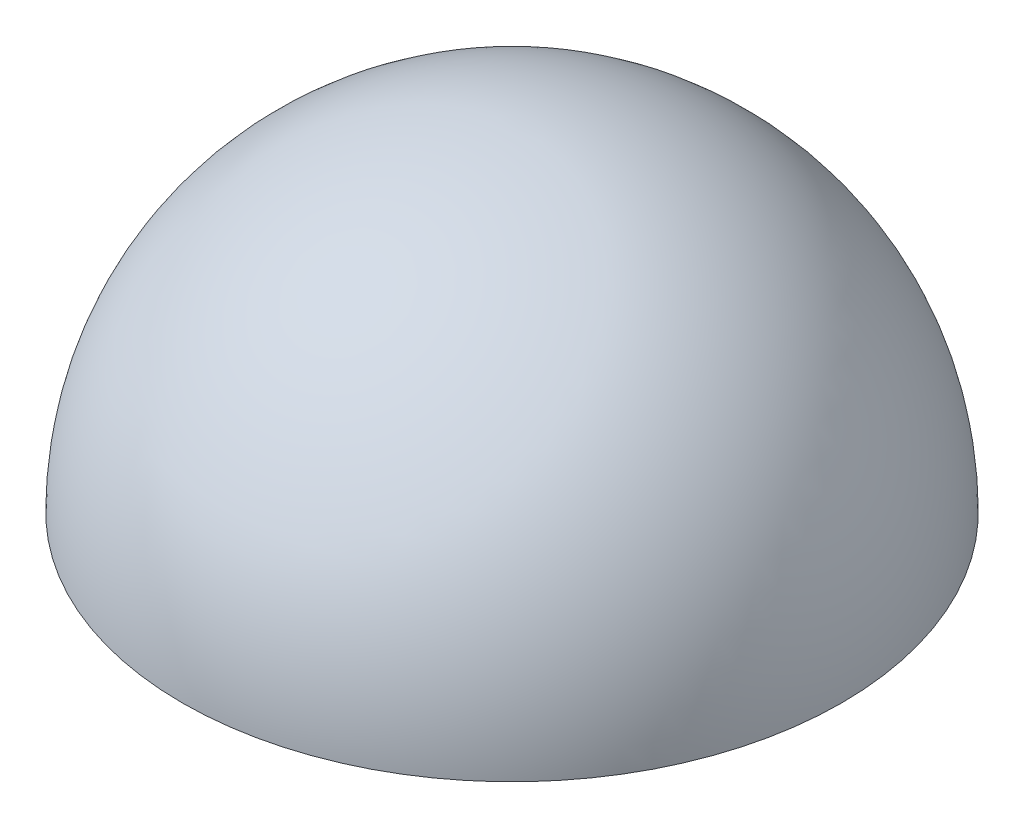
from build123d import *


with BuildPart() as part:
    # Sketch1 → Revolve1 (revolve)
    with BuildSketch(Plane.XY):
        with BuildLine():
            Line((0, 7.5), (0, 6.5))
            ThreePointArc((0, 6.5), (4.596194078, 4.596194078), (6.5, 0))
            Line((6.5, 0), (7.5, 0))
            ThreePointArc((7.5, 0), (5.303300859, 5.303300859), (0, 7.5))
        make_face()
    revolve(axis=Axis((0, 0, 0), (0, 1, 0)))


solid = part.part
